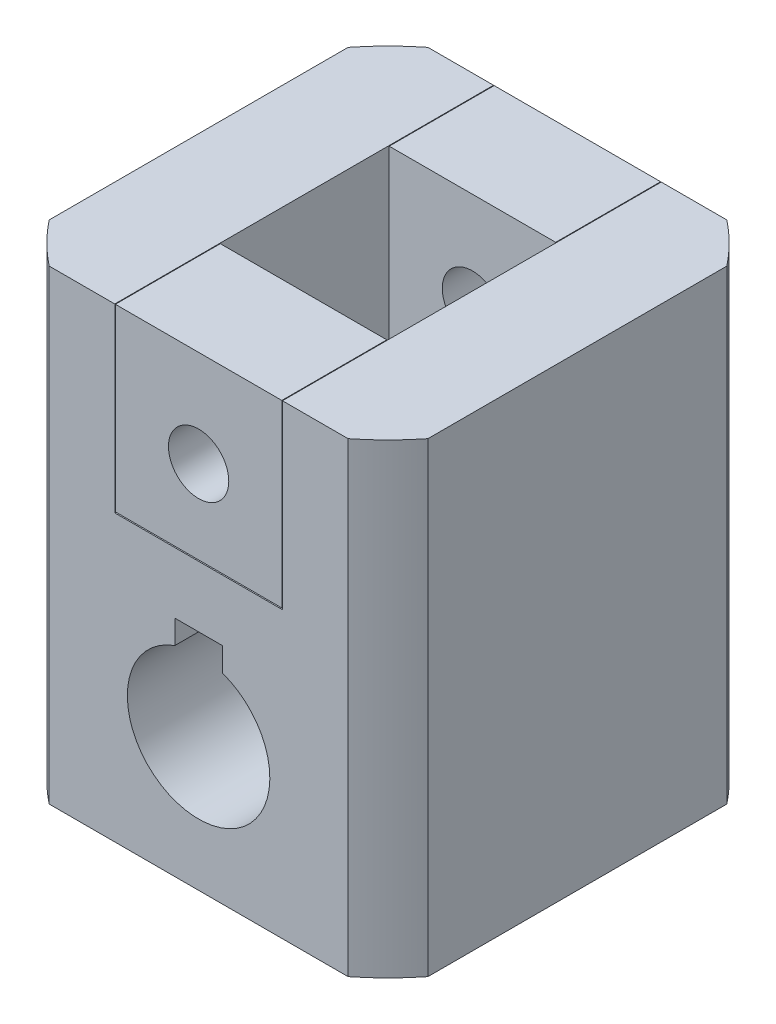
from build123d import *

# Parameters (mm, degrees)
SKETCH1_W             = 39.878
SKETCH1_H             = 39.878
BOSS_EXTRUDE1_DEPTH   = 49.05
SKETCH2_W             = 17.653
SKETCH2_H             = 39.878
CUT_EXTRUDE1_DEPTH    = 19.05
SKETCH4_R             = 30.48
SKETCH4_R_2           = 25.4
CUT_EXTRUDE3_DEPTH    = 57.57764525
CUT_EXTRUDE5_DEPTH    = 67.285149958
SKETCH7_W             = 17.526
SKETCH7_H             = 11.049
BOSS_EXTRUDE2_DEPTH   = 18.923
BOSS_EXTRUDE2_2_DEPTH = 18.923
SKETCH8_R             = 3.175
CUT_EXTRUDE6_DEPTH    = 67.285149958
SKETCH9_R             = 2.1
CUT_EXTRUDE7_DEPTH    = 6.0325


with BuildPart() as part:
    # Sketch1 → Boss-Extrude1 (new body)
    with BuildSketch(Plane(origin=(0, 0, 0), x_dir=(1, 0, 0), z_dir=(0, 1, 0))):
        Rectangle(SKETCH1_W, SKETCH1_H)
    extrude(amount=BOSS_EXTRUDE1_DEPTH)

    # Sketch2 → Cut-Extrude1 (cut)
    with BuildSketch(Plane.XZ.offset(-49.05)):
        Rectangle(SKETCH2_W, SKETCH2_H)
    extrude(amount=CUT_EXTRUDE1_DEPTH, mode=Mode.SUBTRACT)

    # Sketch4 → Cut-Extrude3 (cut, through all)
    with BuildSketch(Plane(origin=(0, 49.05, 0), x_dir=(1, 0, 0), z_dir=(0, 1, 0))):
        Circle(SKETCH4_R)
        Circle(SKETCH4_R_2, mode=Mode.SUBTRACT)
    extrude(amount=-CUT_EXTRUDE3_DEPTH, mode=Mode.SUBTRACT)

    # Sketch6 → Cut-Extrude5 (cut, through all)
    with BuildSketch(Plane.XY.offset(19.939)):
        with BuildLine():
            Line((-2.5, 21.069067812), (-2.5, 23.569067812))
            Line((-2.5, 23.569067812), (2.5, 23.569067812))
            Line((2.5, 23.569067812), (2.5, 21.069067812))
            ThreePointArc((2.5, 21.069067812), (0, 6.498), (-2.5, 21.069067812))
        make_face()
    extrude(amount=-CUT_EXTRUDE5_DEPTH, mode=Mode.SUBTRACT)

    # Sketch9 → Cut-Extrude7 (cut)
    with BuildSketch(Plane(origin=(-19.939, 0, 0), x_dir=(0, 0, -1), z_dir=(1, 0, 0))):
        with Locations((0, 42.7)):
            Circle(SKETCH9_R)
        with Locations((0, 30)):
            Circle(SKETCH9_R)
    extrude(amount=CUT_EXTRUDE7_DEPTH, mode=Mode.SUBTRACT)


with BuildPart() as body_2:
    # Sketch7 → Boss-Extrude2 (new body)
    with BuildSketch(Plane(origin=(0, 49.05, 0), x_dir=(1, 0, 0), z_dir=(0, 1, 0))):
        with Locations((0, -14.4145)):
            Rectangle(SKETCH7_W, SKETCH7_H)
    extrude(amount=-BOSS_EXTRUDE2_DEPTH)


with BuildPart() as body_3:
    # Sketch7 → Boss-Extrude2 2 (new body)
    with BuildSketch(Plane(origin=(0, 49.05, 0), x_dir=(1, 0, 0), z_dir=(0, 1, 0))):
        with Locations((0, 14.4145)):
            Rectangle(SKETCH7_W, SKETCH7_H)
    extrude(amount=-BOSS_EXTRUDE2_2_DEPTH)


with BuildPart() as cut_extrude6_tool:
    # Sketch8 → Cut-Extrude6 (new, through all)
    with BuildSketch(Plane.XY.offset(19.939)):
        with Locations((0, 38.89)):
            Circle(SKETCH8_R)
    extrude(amount=-CUT_EXTRUDE6_DEPTH)


with BuildPart() as body_2_1:
    add(body_2.part)

    # Cut-Extrude6: cut by cut_extrude6_tool
    add(cut_extrude6_tool.part, mode=Mode.SUBTRACT)


with BuildPart() as body_3_1:
    add(body_3.part)

    # Cut-Extrude6: cut by cut_extrude6_tool
    add(cut_extrude6_tool.part, mode=Mode.SUBTRACT)


solid = Compound([part.part, body_2_1.part, body_3_1.part])
